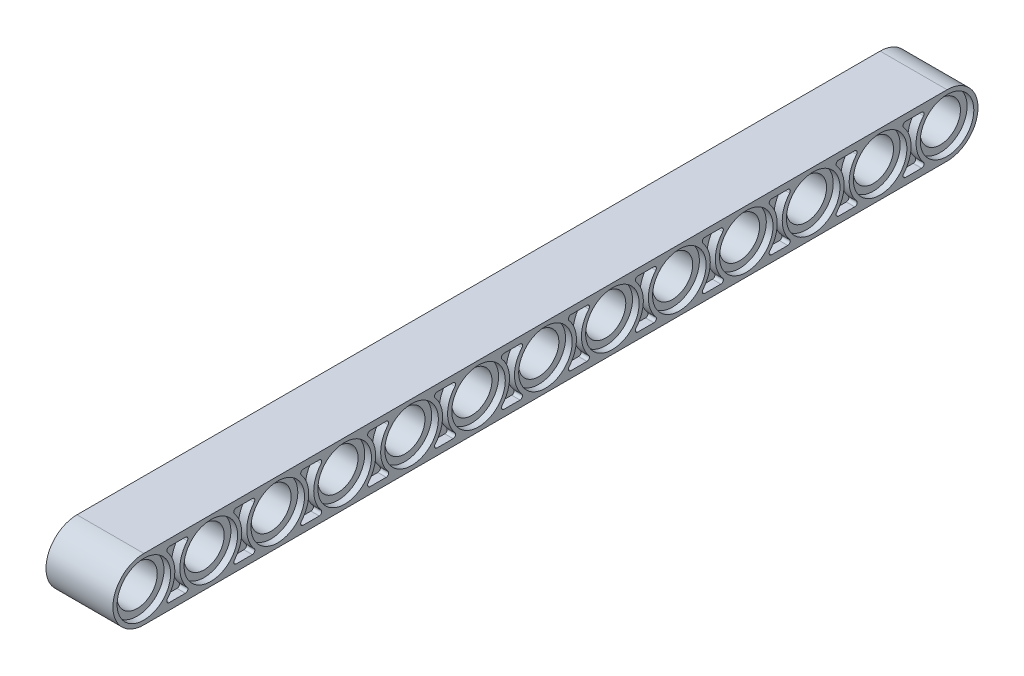
from build123d import *

# Parameters (mm, degrees)
SKETCH1_R           = 2.4
BOSS_EXTRUDE1_DEPTH = 8
SKETCH2_R           = 3.2
CUT_EXTRUDE1_DEPTH  = 0.8
CUT_EXTRUDE2_START  = -1
CUT_EXTRUDE2_DEPTH  = 1


with BuildPart() as part:
    # Sketch1 → Boss-Extrude1 (new body)
    with BuildSketch(Plane(origin=(0, 0, 0), x_dir=(0, 0, -1), z_dir=(1, 0, 0))):
        with BuildLine():
            Line((-34.04, 3.7), (61.96, 3.7))
            ThreePointArc((61.96, 3.7), (65.66, 0), (61.96, -3.7))
            Line((61.96, -3.7), (-34.04, -3.7))
            ThreePointArc((-34.04, -3.7), (-37.74, 0), (-34.04, 3.7))
        make_face()
        with Locations((-34.04, 0)):
            Circle(SKETCH1_R, mode=Mode.SUBTRACT)
        with Locations((-26.04, 0)):
            Circle(SKETCH1_R, mode=Mode.SUBTRACT)
        with Locations((-18.04, 0)):
            Circle(SKETCH1_R, mode=Mode.SUBTRACT)
        with Locations((-10.04, 0)):
            Circle(SKETCH1_R, mode=Mode.SUBTRACT)
        with Locations((-2.04, 0)):
            Circle(SKETCH1_R, mode=Mode.SUBTRACT)
        with Locations((5.96, 0)):
            Circle(SKETCH1_R, mode=Mode.SUBTRACT)
        with Locations((13.96, 0)):
            Circle(SKETCH1_R, mode=Mode.SUBTRACT)
        with Locations((21.96, 0)):
            Circle(SKETCH1_R, mode=Mode.SUBTRACT)
        with Locations((29.96, 0)):
            Circle(SKETCH1_R, mode=Mode.SUBTRACT)
        with Locations((37.96, 0)):
            Circle(SKETCH1_R, mode=Mode.SUBTRACT)
        with Locations((45.96, 0)):
            Circle(SKETCH1_R, mode=Mode.SUBTRACT)
        with Locations((53.96, 0)):
            Circle(SKETCH1_R, mode=Mode.SUBTRACT)
        with Locations((61.96, 0)):
            Circle(SKETCH1_R, mode=Mode.SUBTRACT)
    extrude(amount=BOSS_EXTRUDE1_DEPTH)

    # Sketch2 → Cut-Extrude1 (cut)
    with BuildSketch(Plane(origin=(8, 0, 0), x_dir=(0, 0, -1), z_dir=(1, 0, 0))):
        with Locations((-34.04, 0)):
            Circle(SKETCH2_R)
        with Locations((-26.04, 0)):
            Circle(SKETCH2_R)
        with Locations((-18.04, 0)):
            Circle(SKETCH2_R)
        with Locations((-10.04, 0)):
            Circle(SKETCH2_R)
        with Locations((-2.04, 0)):
            Circle(SKETCH2_R)
        with Locations((5.96, 0)):
            Circle(SKETCH2_R)
        with Locations((13.96, 0)):
            Circle(SKETCH2_R)
        with Locations((21.96, 0)):
            Circle(SKETCH2_R)
        with Locations((29.96, 0)):
            Circle(SKETCH2_R)
        with Locations((37.96, 0)):
            Circle(SKETCH2_R)
        with Locations((45.96, 0)):
            Circle(SKETCH2_R)
        with Locations((53.96, 0)):
            Circle(SKETCH2_R)
        with Locations((61.96, 0)):
            Circle(SKETCH2_R)
    cut_extrude1 = extrude(amount=-CUT_EXTRUDE1_DEPTH, mode=Mode.SUBTRACT)

    # Sketch4 → Cut-Extrude2 (cut)
    with BuildSketch(Plane(origin=(8, 0, 0), x_dir=(0, 0, -1), z_dir=(1, 0, 0)).offset(CUT_EXTRUDE2_START)):
        with BuildLine():
            Line((-31.000263169, 2.9), (-29.079736831, 2.9))
            ThreePointArc((-29.079736831, 2.9), (-28.807248299, 2.725499004), (-28.851756568, 2.405))
            ThreePointArc((-28.851756568, 2.405), (-29.74, 0), (-28.851756568, -2.405))
            ThreePointArc((-28.851756568, -2.405), (-28.807248299, -2.725499004), (-29.079736831, -2.9))
            Line((-29.079736831, -2.9), (-31.000263169, -2.9))
            ThreePointArc((-31.000263169, -2.9), (-31.272751701, -2.725499004), (-31.228243432, -2.405))
            ThreePointArc((-31.228243432, -2.405), (-30.34, 0), (-31.228243432, 2.405))
            ThreePointArc((-31.228243432, 2.405), (-31.272751701, 2.725499004), (-31.000263169, 2.9))
        make_face()
        with BuildLine():
            Line((-23.000263169, 2.9), (-21.079736831, 2.9))
            ThreePointArc((-21.079736831, 2.9), (-20.807248299, 2.725499004), (-20.851756568, 2.405))
            ThreePointArc((-20.851756568, 2.405), (-21.74, 0), (-20.851756568, -2.405))
            ThreePointArc((-20.851756568, -2.405), (-20.807248299, -2.725499004), (-21.079736831, -2.9))
            Line((-21.079736831, -2.9), (-23.000263169, -2.9))
            ThreePointArc((-23.000263169, -2.9), (-23.272751701, -2.725499004), (-23.228243432, -2.405))
            ThreePointArc((-23.228243432, -2.405), (-22.34, 0), (-23.228243432, 2.405))
            ThreePointArc((-23.228243432, 2.405), (-23.272751701, 2.725499004), (-23.000263169, 2.9))
        make_face()
        with BuildLine():
            Line((-15.000263169, 2.9), (-13.079736831, 2.9))
            ThreePointArc((-13.079736831, 2.9), (-12.807248299, 2.725499004), (-12.851756568, 2.405))
            ThreePointArc((-12.851756568, 2.405), (-13.74, 0), (-12.851756568, -2.405))
            ThreePointArc((-12.851756568, -2.405), (-12.807248299, -2.725499004), (-13.079736831, -2.9))
            Line((-13.079736831, -2.9), (-15.000263169, -2.9))
            ThreePointArc((-15.000263169, -2.9), (-15.272751701, -2.725499004), (-15.228243432, -2.405))
            ThreePointArc((-15.228243432, -2.405), (-14.34, 0), (-15.228243432, 2.405))
            ThreePointArc((-15.228243432, 2.405), (-15.272751701, 2.725499004), (-15.000263169, 2.9))
        make_face()
        with BuildLine():
            Line((-7.000263169, 2.9), (-5.079736831, 2.9))
            ThreePointArc((-5.079736831, 2.9), (-4.807248299, 2.725499004), (-4.851756568, 2.405))
            ThreePointArc((-4.851756568, 2.405), (-5.74, 0), (-4.851756568, -2.405))
            ThreePointArc((-4.851756568, -2.405), (-4.807248299, -2.725499004), (-5.079736831, -2.9))
            Line((-5.079736831, -2.9), (-7.000263169, -2.9))
            ThreePointArc((-7.000263169, -2.9), (-7.272751701, -2.725499004), (-7.228243432, -2.405))
            ThreePointArc((-7.228243432, -2.405), (-6.34, 0), (-7.228243432, 2.405))
            ThreePointArc((-7.228243432, 2.405), (-7.272751701, 2.725499004), (-7.000263169, 2.9))
        make_face()
        with BuildLine():
            Line((0.999736831, 2.9), (2.920263169, 2.9))
            ThreePointArc((2.920263169, 2.9), (3.192751701, 2.725499004), (3.148243432, 2.405))
            ThreePointArc((3.148243432, 2.405), (2.26, 0), (3.148243432, -2.405))
            ThreePointArc((3.148243432, -2.405), (3.192751701, -2.725499004), (2.920263169, -2.9))
            Line((2.920263169, -2.9), (0.999736831, -2.9))
            ThreePointArc((0.999736831, -2.9), (0.727248299, -2.725499004), (0.771756568, -2.405))
            ThreePointArc((0.771756568, -2.405), (1.66, 0), (0.771756568, 2.405))
            ThreePointArc((0.771756568, 2.405), (0.727248299, 2.725499004), (0.999736831, 2.9))
        make_face()
        with BuildLine():
            Line((8.999736831, 2.9), (10.920263169, 2.9))
            ThreePointArc((10.920263169, 2.9), (11.192751701, 2.725499004), (11.148243432, 2.405))
            ThreePointArc((11.148243432, 2.405), (10.26, 0), (11.148243432, -2.405))
            ThreePointArc((11.148243432, -2.405), (11.192751701, -2.725499004), (10.920263169, -2.9))
            Line((10.920263169, -2.9), (8.999736831, -2.9))
            ThreePointArc((8.999736831, -2.9), (8.727248299, -2.725499004), (8.771756568, -2.405))
            ThreePointArc((8.771756568, -2.405), (9.66, 0), (8.771756568, 2.405))
            ThreePointArc((8.771756568, 2.405), (8.727248299, 2.725499004), (8.999736831, 2.9))
        make_face()
        with BuildLine():
            Line((16.999736831, 2.9), (18.920263169, 2.9))
            ThreePointArc((18.920263169, 2.9), (19.192751701, 2.725499004), (19.148243432, 2.405))
            ThreePointArc((19.148243432, 2.405), (18.26, 0), (19.148243432, -2.405))
            ThreePointArc((19.148243432, -2.405), (19.192751701, -2.725499004), (18.920263169, -2.9))
            Line((18.920263169, -2.9), (16.999736831, -2.9))
            ThreePointArc((16.999736831, -2.9), (16.727248299, -2.725499004), (16.771756568, -2.405))
            ThreePointArc((16.771756568, -2.405), (17.66, 0), (16.771756568, 2.405))
            ThreePointArc((16.771756568, 2.405), (16.727248299, 2.725499004), (16.999736831, 2.9))
        make_face()
        with BuildLine():
            Line((24.999736831, 2.9), (26.920263169, 2.9))
            ThreePointArc((26.920263169, 2.9), (27.192751701, 2.725499004), (27.148243432, 2.405))
            ThreePointArc((27.148243432, 2.405), (26.26, 0), (27.148243432, -2.405))
            ThreePointArc((27.148243432, -2.405), (27.192751701, -2.725499004), (26.920263169, -2.9))
            Line((26.920263169, -2.9), (24.999736831, -2.9))
            ThreePointArc((24.999736831, -2.9), (24.727248299, -2.725499004), (24.771756568, -2.405))
            ThreePointArc((24.771756568, -2.405), (25.66, 0), (24.771756568, 2.405))
            ThreePointArc((24.771756568, 2.405), (24.727248299, 2.725499004), (24.999736831, 2.9))
        make_face()
        with BuildLine():
            Line((32.999736831, 2.9), (34.920263169, 2.9))
            ThreePointArc((34.920263169, 2.9), (35.192751701, 2.725499004), (35.148243432, 2.405))
            ThreePointArc((35.148243432, 2.405), (34.26, 0), (35.148243432, -2.405))
            ThreePointArc((35.148243432, -2.405), (35.192751701, -2.725499004), (34.920263169, -2.9))
            Line((34.920263169, -2.9), (32.999736831, -2.9))
            ThreePointArc((32.999736831, -2.9), (32.727248299, -2.725499004), (32.771756568, -2.405))
            ThreePointArc((32.771756568, -2.405), (33.66, 0), (32.771756568, 2.405))
            ThreePointArc((32.771756568, 2.405), (32.727248299, 2.725499004), (32.999736831, 2.9))
        make_face()
        with BuildLine():
            Line((40.999736831, 2.9), (42.920263169, 2.9))
            ThreePointArc((42.920263169, 2.9), (43.192751701, 2.725499004), (43.148243432, 2.405))
            ThreePointArc((43.148243432, 2.405), (42.26, 0), (43.148243432, -2.405))
            ThreePointArc((43.148243432, -2.405), (43.192751701, -2.725499004), (42.920263169, -2.9))
            Line((42.920263169, -2.9), (40.999736831, -2.9))
            ThreePointArc((40.999736831, -2.9), (40.727248299, -2.725499004), (40.771756568, -2.405))
            ThreePointArc((40.771756568, -2.405), (41.66, 0), (40.771756568, 2.405))
            ThreePointArc((40.771756568, 2.405), (40.727248299, 2.725499004), (40.999736831, 2.9))
        make_face()
        with BuildLine():
            Line((48.999736831, 2.9), (50.920263169, 2.9))
            ThreePointArc((50.920263169, 2.9), (51.192751701, 2.725499004), (51.148243432, 2.405))
            ThreePointArc((51.148243432, 2.405), (50.26, 0), (51.148243432, -2.405))
            ThreePointArc((51.148243432, -2.405), (51.192751701, -2.725499004), (50.920263169, -2.9))
            Line((50.920263169, -2.9), (48.999736831, -2.9))
            ThreePointArc((48.999736831, -2.9), (48.727248299, -2.725499004), (48.771756568, -2.405))
            ThreePointArc((48.771756568, -2.405), (49.66, 0), (48.771756568, 2.405))
            ThreePointArc((48.771756568, 2.405), (48.727248299, 2.725499004), (48.999736831, 2.9))
        make_face()
        with BuildLine():
            Line((56.999736831, 2.9), (58.920263169, 2.9))
            ThreePointArc((58.920263169, 2.9), (59.192751701, 2.725499004), (59.148243432, 2.405))
            ThreePointArc((59.148243432, 2.405), (58.26, 0), (59.148243432, -2.405))
            ThreePointArc((59.148243432, -2.405), (59.192751701, -2.725499004), (58.920263169, -2.9))
            Line((58.920263169, -2.9), (56.999736831, -2.9))
            ThreePointArc((56.999736831, -2.9), (56.727248299, -2.725499004), (56.771756568, -2.405))
            ThreePointArc((56.771756568, -2.405), (57.66, 0), (56.771756568, 2.405))
            ThreePointArc((56.771756568, 2.405), (56.727248299, 2.725499004), (56.999736831, 2.9))
        make_face()
    cut_extrude2 = extrude(amount=CUT_EXTRUDE2_DEPTH, mode=Mode.SUBTRACT)

    # Mirror1: Cut-Extrude1, Cut-Extrude2 across plane
    add(cut_extrude1.mirror(Plane(origin=(4, 0, 0), x_dir=(0, 0, 1), z_dir=(1, 0, 0))), mode=Mode.SUBTRACT)
    add(cut_extrude2.mirror(Plane(origin=(4, 0, 0), x_dir=(0, 0, 1), z_dir=(1, 0, 0))), mode=Mode.SUBTRACT)


solid = part.part
